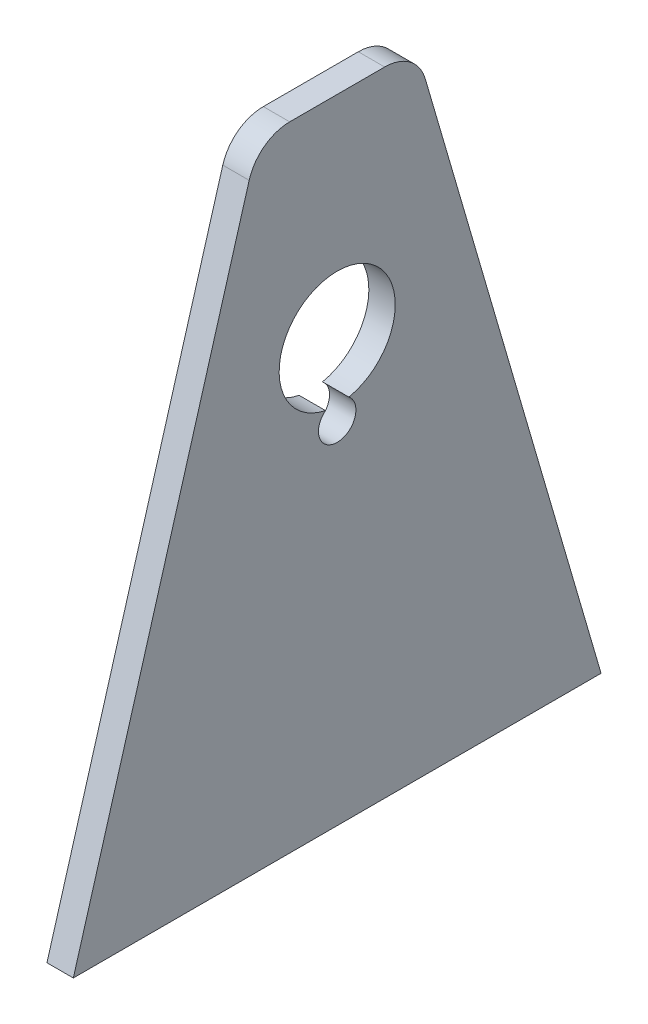
from build123d import *

# Parameters (mm, degrees)
BOSS_EXTRUDE1_DEPTH = 6.35
FILLET2_R           = 10.16


with BuildPart() as part:
    # Sketch1 → Boss-Extrude1 (new body)
    with BuildSketch(Plane(origin=(0, 0, 0), x_dir=(0, 0, -1), z_dir=(1, 0, 0))):
        Polygon((-63.5, -101.6), (-19.05, 50.8), (19.05, 50.8), (63.5, -101.6), align=None)
        with BuildLine():
            ThreePointArc((2.811655808, -13.684132841), (0, 13.97), (-2.811655808, -13.684132841))
            ThreePointArc((-2.811655808, -13.684132841), (0, -21.717), (2.811655808, -13.684132841))
        make_face(mode=Mode.SUBTRACT)
    extrude(amount=BOSS_EXTRUDE1_DEPTH)

    # Fillet2
    fillet2_edges = [part.edges().sort_by_distance(p)[0] for p in [
        (3.175, 50.8, 19.05),
        (3.175, 50.8, -19.05),
    ]]
    fillet(fillet2_edges, radius=FILLET2_R)


solid = part.part
